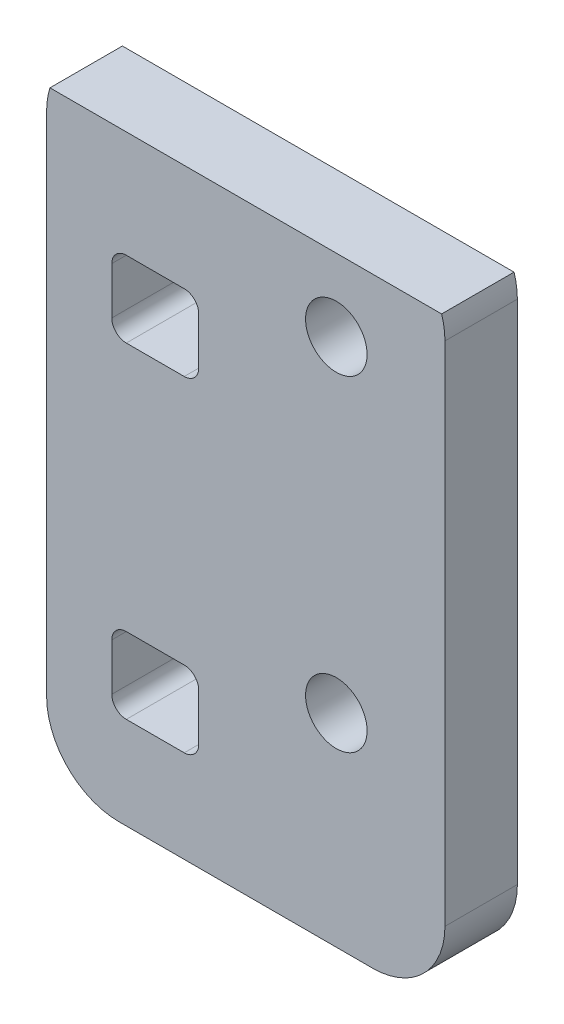
from build123d import *

# Parameters (mm, degrees)
SKETCH2_W           = 55
SKETCH2_H           = 90
SKETCH2_R           = 4.25
BOSS_EXTRUDE1_DEPTH = 10
FILLET1_R           = 10
CUT_EXTRUDE1_DEPTH  = 600


with BuildPart() as part:
    # Sketch2 → Boss-Extrude1 (new body)
    with BuildSketch(Plane.XY):
        with Locations((46.5, 265.320623632)):
            Rectangle(SKETCH2_W, SKETCH2_H)
        with Locations((59, 293.320623632)):
            Circle(SKETCH2_R, mode=Mode.SUBTRACT)
        with Locations((59, 248.320623632)):
            Circle(SKETCH2_R, mode=Mode.SUBTRACT)
        with BuildLine():
            Line((30, 278.070623632), (38, 278.070623632))
            ThreePointArc((38, 278.070623632), (39.414213562, 278.656410069), (40, 280.070623632))
            Line((40, 280.070623632), (40, 286.570623632))
            ThreePointArc((40, 286.570623632), (39.414213562, 287.984837194), (38, 288.570623632))
            Line((38, 288.570623632), (30, 288.570623632))
            ThreePointArc((30, 288.570623632), (28.585786438, 287.984837194), (28, 286.570623632))
            Line((28, 286.570623632), (28, 280.070623632))
            ThreePointArc((28, 280.070623632), (28.585786438, 278.656410069), (30, 278.070623632))
        make_face(mode=Mode.SUBTRACT)
        with BuildLine():
            Line((30, 233.070623632), (38, 233.070623632))
            ThreePointArc((38, 233.070623632), (39.414213562, 233.656410069), (40, 235.070623632))
            Line((40, 235.070623632), (40, 241.570623632))
            ThreePointArc((40, 241.570623632), (39.414213562, 242.984837194), (38, 243.570623632))
            Line((38, 243.570623632), (30, 243.570623632))
            ThreePointArc((30, 243.570623632), (28.585786438, 242.984837194), (28, 241.570623632))
            Line((28, 241.570623632), (28, 235.070623632))
            ThreePointArc((28, 235.070623632), (28.585786438, 233.656410069), (30, 233.070623632))
        make_face(mode=Mode.SUBTRACT)
    extrude(amount=BOSS_EXTRUDE1_DEPTH)

    # Fillet1
    fillet1_edges = [part.edges().sort_by_distance(p)[0] for p in [
        (74, 220.320623632, 5),
        (19, 220.320623632, 5),
        (19, 310.320623632, 5),
        (74, 310.320623632, 5),
    ]]
    fillet(fillet1_edges, radius=FILLET1_R)

    # Sketch4 → Cut-Extrude1 (cut)
    with BuildSketch(Plane(origin=(-127, 1084.797720172, -1205.109910301), x_dir=(0, 1, 0), z_dir=(-1, 0, 0))):
        Polygon((-781.47709654, -1215.209910301), (-501.47709654, -1215.209910301), (-501.47709654, -743.209910301), (-781.47709654, -743.2099103), align=None)
        with BuildLine():
            Line((-206.47709654, -743.209910301), (-96.47709654, -743.209910301))
            ThreePointArc((-96.47709654, -743.209910301), (-89.406028728, -746.138842489), (-86.47709654, -753.209910301))
            Line((-86.47709654, -753.209910301), (-86.47709654, -1205.209910301))
            ThreePointArc((-86.47709654, -1205.209910301), (-89.406028728, -1212.280978113), (-96.47709654, -1215.209910301))
            Line((-96.47709654, -1215.209910301), (-206.47709654, -1215.209910301))
            ThreePointArc((-206.47709654, -1215.209910301), (-213.548164352, -1212.280978113), (-216.47709654, -1205.209910301))
            Line((-216.47709654, -1205.209910301), (-216.47709654, -753.209910301))
            ThreePointArc((-216.47709654, -753.209910301), (-213.548164352, -746.138842489), (-206.47709654, -743.209910301))
        make_face()
    extrude(amount=-CUT_EXTRUDE1_DEPTH, mode=Mode.SUBTRACT)


solid = part.part
